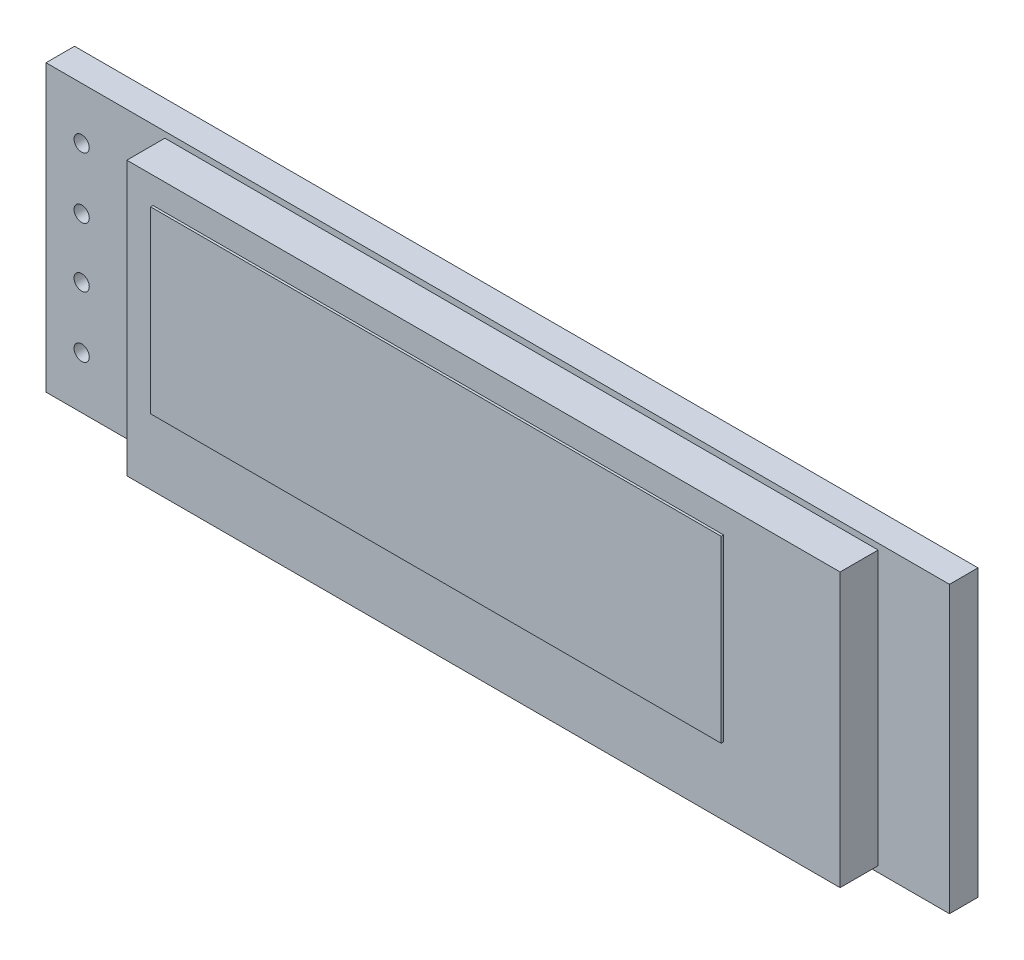
from build123d import *

# Parameters (mm, degrees)
SKETCH1_W           = 38
SKETCH1_H           = 12
BOSS_EXTRUDE1_DEPTH = 1.2
SKETCH2_W           = 30
SKETCH2_H           = 11.5
BOSS_EXTRUDE2_DEPTH = 1.6
SKETCH4_W           = 24
SKETCH4_H           = 7.54
BOSS_EXTRUDE6_DEPTH = 0.1
SKETCH5_R           = 0.32
CUT_EXTRUDE1_DEPTH  = 1.2


with BuildPart() as part:
    # Sketch1 → Boss-Extrude1 (new body)
    with BuildSketch(Plane.XY):
        Rectangle(SKETCH1_W, SKETCH1_H)
    extrude(amount=BOSS_EXTRUDE1_DEPTH)

    # Sketch2 → Boss-Extrude2 (add)
    with BuildSketch(Plane.XY.offset(1.2)):
        with Locations((1, 0)):
            Rectangle(SKETCH2_W, SKETCH2_H)
    extrude(amount=BOSS_EXTRUDE2_DEPTH)

    # Sketch4 → Boss-Extrude6 (add)
    with BuildSketch(Plane.XY.offset(2.8)):
        with Locations((-0.9, 0.88)):
            Rectangle(SKETCH4_W, SKETCH4_H)
    extrude(amount=BOSS_EXTRUDE6_DEPTH)

    # Sketch5 → Cut-Extrude1 (cut)
    with BuildSketch(Plane(origin=(0, 0, 0), x_dir=(-1, 0, 0), z_dir=(0, 0, -1))):
        with Locations((17.5, 3.81)):
            Circle(SKETCH5_R)
        with Locations((17.5, 1.25)):
            Circle(SKETCH5_R)
        with Locations((17.5, -1.25)):
            Circle(SKETCH5_R)
        with Locations((17.5, -3.81)):
            Circle(SKETCH5_R)
    extrude(amount=-CUT_EXTRUDE1_DEPTH, mode=Mode.SUBTRACT)


solid = part.part
